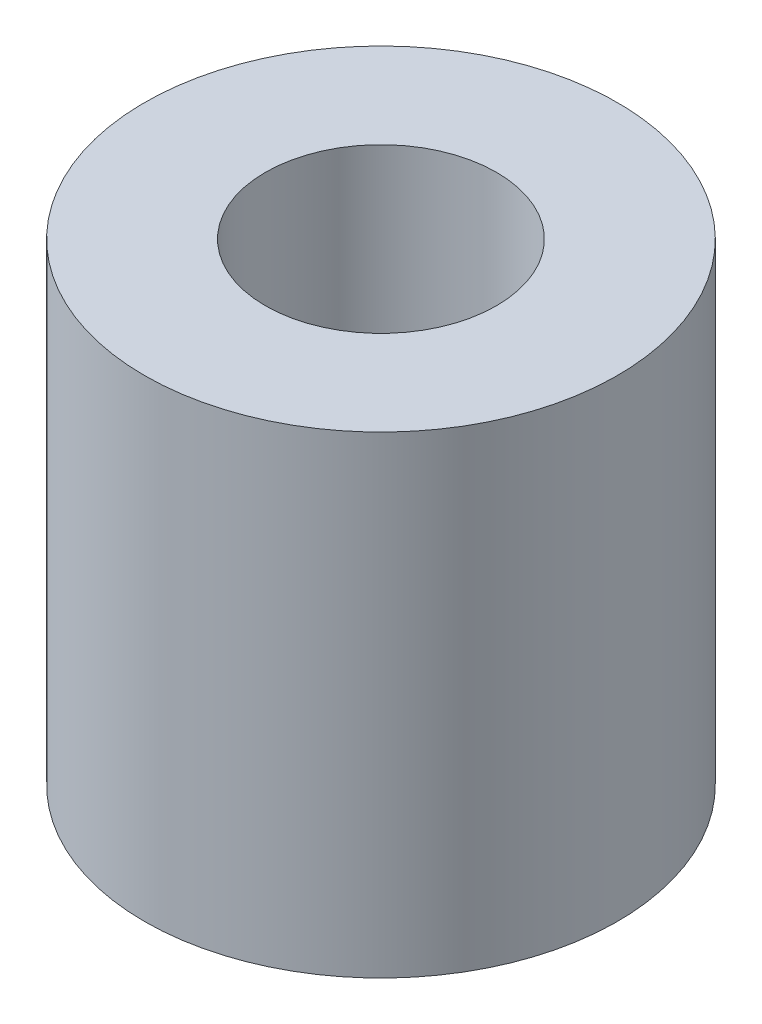
from build123d import *

# Parameters (mm, degrees)
SKETCH1_R           = 2.25
SKETCH1_R_2         = 1.1
BOSS_EXTRUDE1_DEPTH = 4.5


with BuildPart() as part:
    # Sketch1 → Boss-Extrude1 (new body)
    with BuildSketch(Plane(origin=(0, 0, 0), x_dir=(1, 0, 0), z_dir=(0, 1, 0))):
        with Locations(Location((0, 0, 0), (0, 0, 270))):
            Circle(SKETCH1_R)
        with Locations(Location((0, 0, 0), (0, 0, 270))):
            Circle(SKETCH1_R_2, mode=Mode.SUBTRACT)
    extrude(amount=BOSS_EXTRUDE1_DEPTH)


solid = part.part
